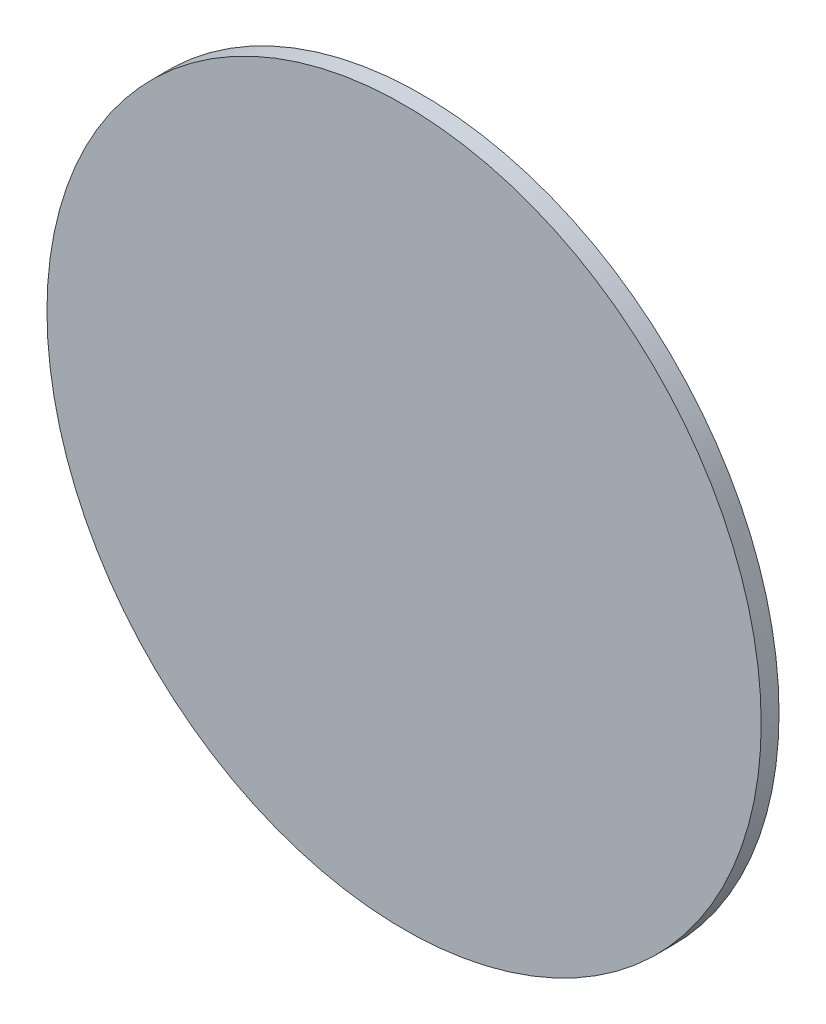
from build123d import *

# Parameters (mm, degrees)
SKETCH_1_R      = 20
EXTRUDE_1_DEPTH = 1


with BuildPart() as part:
    # 草图1 → 凸台-拉伸1 (new body)
    with BuildSketch(Plane.XY):
        Circle(SKETCH_1_R)
    extrude(amount=EXTRUDE_1_DEPTH)


solid = part.part
